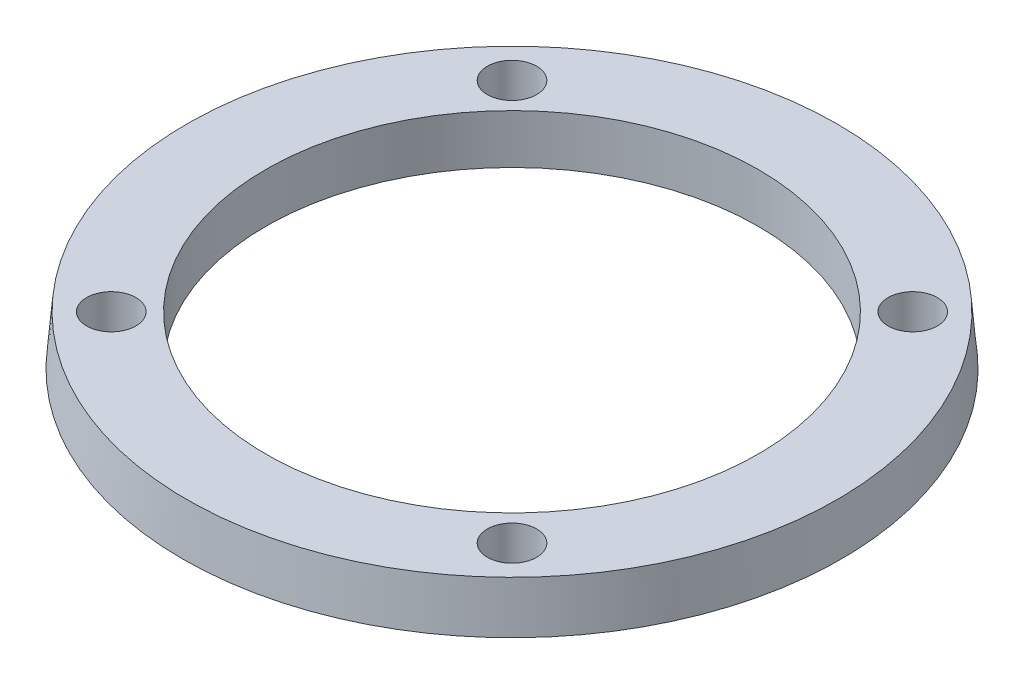
from build123d import *

# Parameters (mm, degrees)
SKETCH3_R          = 2
CUT_EXTRUDE1_DEPTH = 39.041096199


with BuildPart() as part:
    # Sketch1 → Revolve1 (revolve)
    with BuildSketch(Plane.XY, mode=Mode.PRIVATE) as revolve1_sk:
        Polygon((-26.75, 0), (-26.400045346, 4), (-20, 4), (-20, 0), align=None)
    revolve(revolve1_sk.sketch.rotate(Axis((0, 0, 0), (0, 1, 0)), 270), axis=Axis((0, 0, 0), (0, 1, 0)))

    # Sketch3 → Cut-Extrude1 (cut, through all)
    with BuildSketch(Plane.XZ):
        with Locations(Location((-16.263455967, 16.263455967, 0), (0, 0, 270))):
            Circle(SKETCH3_R)
        with Locations(Location((16.263455967, 16.263455967, 0), (0, 0, 270))):
            Circle(SKETCH3_R)
        with Locations(Location((-16.263455967, -16.263455967, 0), (0, 0, 270))):
            Circle(SKETCH3_R)
        with Locations(Location((16.263455967, -16.263455967, 0), (0, 0, 270))):
            Circle(SKETCH3_R)
    extrude(amount=-CUT_EXTRUDE1_DEPTH, mode=Mode.SUBTRACT)


solid = part.part
